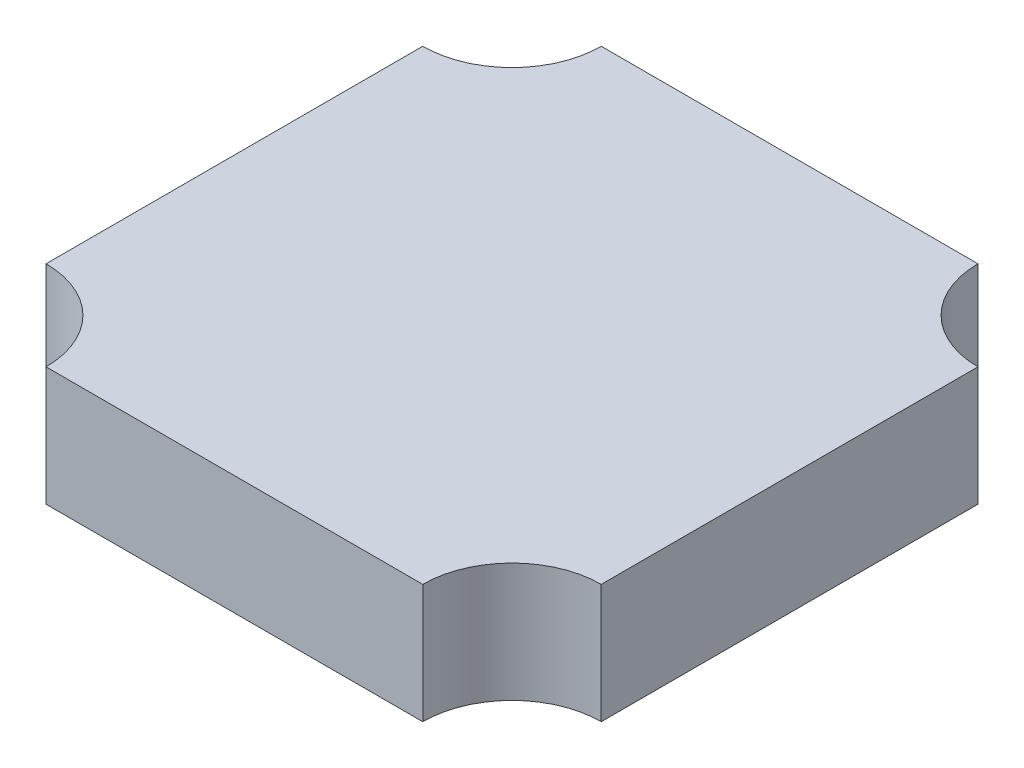
from build123d import *

# Parameters (mm, degrees)
BOSS_EXTRUDE1_DEPTH = 12


with BuildPart() as part:
    # Sketch1 → Boss-Extrude1 (new body)
    with BuildSketch(Plane(origin=(0, 0, 0), x_dir=(1, 0, 0), z_dir=(0, 1, 0))):
        with BuildLine():
            Line((-19, 28), (19, 28))
            ThreePointArc((19, 28), (21.636038969, 21.636038969), (28, 19))
            Line((28, 19), (28, -19))
            ThreePointArc((28, -19), (21.636038969, -21.636038969), (19, -28))
            Line((19, -28), (-19, -28))
            ThreePointArc((-19, -28), (-21.636038969, -21.636038969), (-28, -19))
            Line((-28, -19), (-28, 19))
            ThreePointArc((-28, 19), (-21.636038969, 21.636038969), (-19, 28))
        make_face()
    extrude(amount=BOSS_EXTRUDE1_DEPTH)


solid = part.part
